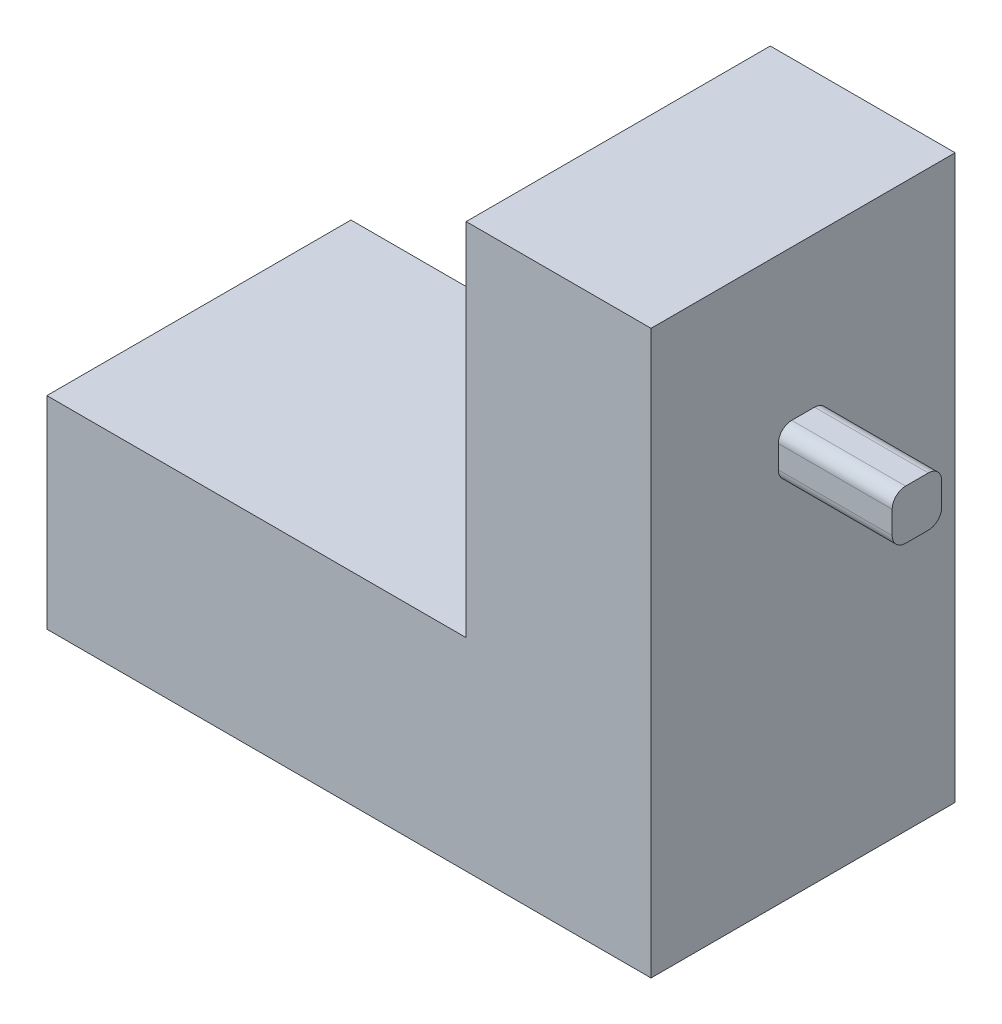
from build123d import *

# Parameters (mm, degrees)
RESSALTO_EXTRUS_O1_DEPTH = 22.7
ESBO_O2_W                = 8.5
ESBO_O2_H                = 3.7
CORTE_EXTRUS_O1_DEPTH    = 9.5
ESBO_O3_W                = 8.527883753
ESBO_O3_H                = 4.058843418
CORTE_EXTRUS_O2_DEPTH    = 9.5
FILETE4_R                = 1


with BuildPart() as part:
    # Esboço1 → Ressalto-extrusão1 (new body)
    with BuildSketch(Plane.XY):
        Polygon((-52.043977441, 13.555253824), (-52.043977441, -1.544746176), (-6.943977441, -1.544746176), (-6.943977441, 25.555253824), (1.556022559, 25.555253824), (1.556022559, 29.255253824), (-6.943977441, 29.255253824), (-6.943977441, 40.455253824), (-20.743977441, 40.455253824), (-20.743977441, 13.555253824), align=None)
    extrude(amount=RESSALTO_EXTRUS_O1_DEPTH)

    # Esboço2 → Corte-extrusão1 (cut)
    with BuildSketch(Plane.XY.offset(22.7)):
        with Locations((-2.693977441, 27.405253824)):
            Rectangle(ESBO_O2_W, ESBO_O2_H)
    extrude(amount=-CORTE_EXTRUS_O1_DEPTH, mode=Mode.SUBTRACT)

    # Esboço3 → Corte-extrusão2 (cut)
    with BuildSketch(Plane(origin=(0, 0, 0), x_dir=(-1, 0, 0), z_dir=(0, 0, -1))):
        with Locations((2.680035565, 27.225832115)):
            Rectangle(ESBO_O3_W, ESBO_O3_H)
    extrude(amount=-CORTE_EXTRUS_O2_DEPTH, mode=Mode.SUBTRACT)

    # Filete4
    filete4_edges = [part.edges().sort_by_distance(p)[0] for p in [
        (-2.693977441, 29.255253824, 13.2),
        (-2.693977441, 25.555253824, 13.2),
        (-2.693977441, 25.555253824, 9.5),
        (-2.693977441, 29.255253824, 9.5),
    ]]
    fillet(filete4_edges, radius=FILETE4_R)


solid = part.part
